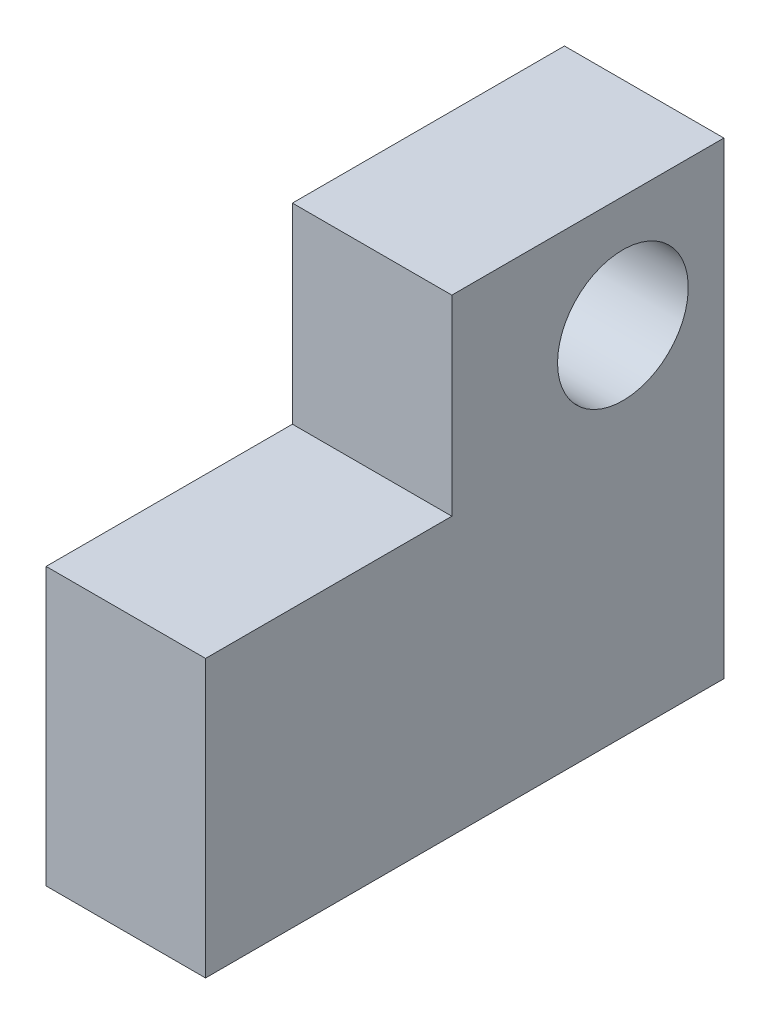
from build123d import *

# Parameters (mm, degrees)
SKETCH1_W            = 42.5
SKETCH1_H            = 55.85
BOSS_EXTRUDE2_DEPTH  = 42.5
SKETCH5_R            = 3
CUT_EXTRUDE2_DEPTH   = 42.5
SKETCH6_W            = 42.5
SKETCH6_H            = 42.5
CUT_EXTRUDE3_DEPTH   = 39.5
SKETCH7_R            = 12
SKETCH7_R_2          = 1.5
CUT_EXTRUDE4_DEPTH   = 39.5
SKETCH9_W            = 10
SKETCH9_H            = 42.5
CUT_EXTRUDE5_DEPTH   = 39.5
CHAMFER1_SIZE        = 3
CHAMFER2_SIZE        = 2
SKETCH10_W           = 2
SKETCH10_H           = 2.21509362
BOSS_EXTRUDE3_DEPTH  = 3
SKETCH12_W           = 2
SKETCH12_H           = 3
BOSS_EXTRUDE4_DEPTH  = 3
BOSS_EXTRUDE5_DEPTH  = 2
BOSS_EXTRUDE6_DEPTH  = 2
SKETCH16_W           = 9
SKETCH16_H           = 9
SKETCH16_R           = 3.175
BOSS_EXTRUDE8_DEPTH  = 5
SKETCH17_R           = 3
CUT_EXTRUDE6_DEPTH   = 5
SKETCH18_W           = 9
SKETCH18_H           = 7.183282928
BOSS_EXTRUDE9_DEPTH  = 2
SKETCH19_R           = 3.175
CUT_EXTRUDE7_DEPTH   = 5
SKETCH20_W           = 36.5
SKETCH20_H           = 45.349147475
CUT_EXTRUDE9_DEPTH   = 66
CUT_EXTRUDE10_DEPTH  = 66
SKETCH22_R           = 12
SKETCH22_R_2         = 11.45
SKETCH22_R_3         = 1.5
SKETCH22_R_4         = 1.55
BOSS_EXTRUDE13_DEPTH = 3
SKETCH23_W           = 42.5
SKETCH23_H           = 7.46509362
CUT_EXTRUDE11_DEPTH  = 3
CHAMFER3_SIZE        = 2
SKETCH24_R           = 13.75
SKETCH24_R_2         = 11.45
BOSS_EXTRUDE14_DEPTH = 4
BOSS_EXTRUDE15_START = 10
SKETCH25_W           = 42.5
SKETCH25_H           = 33.508189308
SKETCH25_R           = 3.175
BOSS_EXTRUDE15_DEPTH = 10
CUT_EXTRUDE12_DEPTH  = 142
CHAMFER4_SIZE        = 10
SKETCH27_W           = 1.831902159
SKETCH27_H           = 1.026975453
BOSS_EXTRUDE16_DEPTH = 0.2
SKETCH28_R           = 3.175
BOSS_EXTRUDE17_DEPTH = 10
SKETCH29_R           = 6.15
BOSS_EXTRUDE19_DEPTH = 15
CUT_EXTRUDE13_DEPTH  = 50


with BuildPart() as part:
    # Sketch1 → Boss-Extrude2 (new body)
    with BuildSketch(Plane.XY):
        with Locations((-16.653499003, 3.960644895)):
            Rectangle(SKETCH1_W, SKETCH1_H)
    extrude(amount=BOSS_EXTRUDE2_DEPTH)

    # Sketch5 → Cut-Extrude2 (cut)
    with BuildSketch(Plane.XY.offset(42.5)):
        with Locations((-31.903499003, 25.965832134)):
            Circle(SKETCH5_R)
        with Locations(Location((-1.403499003, 25.965832134, 0), (0, 0, 180))):
            Circle(SKETCH5_R)
    extrude(amount=-CUT_EXTRUDE2_DEPTH, mode=Mode.SUBTRACT)

    # Sketch6 → Cut-Extrude3 (cut)
    with BuildSketch(Plane.ZY.offset(37.903499003)):
        with Locations((21.25, -0.499261485)):
            Rectangle(SKETCH6_W, SKETCH6_H)
    extrude(amount=-CUT_EXTRUDE3_DEPTH, mode=Mode.SUBTRACT)

    # Sketch7 → Cut-Extrude4 (cut)
    with BuildSketch(Plane(origin=(4.596500997, 0, 0), x_dir=(0, 0, -1), z_dir=(1, 0, 0))):
        with Locations((-21.25, -0.499261485)):
            Circle(SKETCH7_R)
        with Locations((-37, -16.249261485)):
            Circle(SKETCH7_R_2)
        with Locations((-5.5, -16.249261485)):
            Circle(SKETCH7_R_2)
        with Locations((-37, 14.750738515)):
            Circle(SKETCH7_R_2)
        with Locations((-5.5, 14.750738515)):
            Circle(SKETCH7_R_2)
    extrude(amount=-CUT_EXTRUDE4_DEPTH, mode=Mode.SUBTRACT)

    # Sketch9 → Cut-Extrude5 (cut)
    with BuildSketch(Plane.XZ.offset(23.964355105)):
        with Locations((-32.903499003, 21.25)):
            Rectangle(SKETCH9_W, SKETCH9_H)
    extrude(amount=-CUT_EXTRUDE5_DEPTH, mode=Mode.SUBTRACT)

    # Chamfer1
    chamfer1_edges = [part.edges().sort_by_distance(p)[0] for p in [
        (-37.903499003, 20.750738515, 21.25),
        (-37.903499003, 31.885644895, 21.25),
    ]]
    chamfer(chamfer1_edges, length=CHAMFER1_SIZE)

    # Chamfer2
    chamfer2_edges = [part.edges().sort_by_distance(p)[0] for p in [
        (4.596500997, -23.964355105, 21.25),
    ]]
    chamfer(chamfer2_edges, length=CHAMFER2_SIZE)

    # Sketch10 → Boss-Extrude3 (add)
    with BuildSketch(Plane.ZY.offset(27.903499003)):
        with Locations((43.5, -22.856808295)):
            Rectangle(SKETCH10_W, SKETCH10_H)
        with Locations((-1, -22.856808295)):
            Rectangle(SKETCH10_W, SKETCH10_H)
    extrude(amount=-BOSS_EXTRUDE3_DEPTH)

    # Sketch12 → Boss-Extrude4 (add)
    with BuildSketch(Plane.ZY.offset(-1.596500997)):
        with Locations((43.5, 19.250738515)):
            Rectangle(SKETCH12_W, SKETCH12_H)
        with Locations((-1, 19.250738515)):
            Rectangle(SKETCH12_W, SKETCH12_H)
    extrude(amount=-BOSS_EXTRUDE4_DEPTH)

    # Sketch13 → Boss-Extrude5 (add)
    with BuildSketch(Plane(origin=(0, 0, -2), x_dir=(-1, 0, 0), z_dir=(0, 0, -1))):
        Polygon((-1.596500997, 17.750738515), (24.903499003, -21.749261485), (27.903499003, -21.749261485), (-1.596500997, 20.750738515), align=None)
    extrude(amount=-BOSS_EXTRUDE5_DEPTH)

    # Sketch14 → Boss-Extrude6 (add)
    with BuildSketch(Plane.XY.offset(44.5)):
        Polygon((1.596500997, 17.750738515), (-24.903499003, -21.749261485), (-27.903499003, -21.749261485), (1.596500997, 20.750738515), align=None)
    extrude(amount=-BOSS_EXTRUDE6_DEPTH)

    # Sketch16 → Boss-Extrude8 (add)
    # profile 1 of 2: a face of its own
    with BuildSketch(Plane(origin=(4.596500997, 0, 0), x_dir=(0, 0, -1), z_dir=(1, 0, 0))):
        with Locations((-38, 34.568927823)):
            Rectangle(SKETCH16_W, SKETCH16_H)
        with Locations((-38, 34.568927823)):
            Circle(SKETCH16_R, mode=Mode.SUBTRACT)
    # profile 2 of 2: a face of its own
    with BuildSketch(Plane(origin=(4.596500997, 0, 0), x_dir=(0, 0, -1), z_dir=(1, 0, 0))):
        with Locations((-4.5, 34.568927823)):
            Rectangle(SKETCH16_W, SKETCH16_H)
        with Locations((-4.5, 34.568927823)):
            Circle(SKETCH16_R, mode=Mode.SUBTRACT)
    extrude(amount=-BOSS_EXTRUDE8_DEPTH)

    # Sketch17 → Cut-Extrude6 (cut)
    with BuildSketch(Plane(origin=(4.596500997, 0, 0), x_dir=(0, 0, -1), z_dir=(1, 0, 0))):
        with Locations((-38, 34.568927823)):
            Circle(SKETCH17_R)
        with Locations((-4.5, 34.568927823)):
            Circle(SKETCH17_R)
    extrude(amount=-CUT_EXTRUDE6_DEPTH, mode=Mode.SUBTRACT)

    # Sketch18 → Boss-Extrude9 (add)
    with BuildSketch(Plane.ZY.offset(0.403499003)):
        with Locations((4.5, 35.477286359)):
            Rectangle(SKETCH18_W, SKETCH18_H)
        with Locations((38, 35.477286359)):
            Rectangle(SKETCH18_W, SKETCH18_H)
    extrude(amount=BOSS_EXTRUDE9_DEPTH)

    # Sketch19 → Cut-Extrude7 (cut)
    with BuildSketch(Plane(origin=(4.596500997, 0, 0), x_dir=(0, 0, -1), z_dir=(1, 0, 0))):
        with Locations((-38, 34.568927823)):
            Circle(SKETCH19_R)
        with Locations(Location((-4.5, 34.568927823, 0), (0, 0, 180))):
            Circle(SKETCH19_R)
    extrude(amount=-CUT_EXTRUDE7_DEPTH, mode=Mode.SUBTRACT)

    # Sketch20 → Cut-Extrude9 (cut, symmetric)
    with BuildSketch(Plane.XY.offset(42.5)):
        with Locations((-16.653499003, -1.923835222)):
            Rectangle(SKETCH20_W, SKETCH20_H)
    extrude(amount=CUT_EXTRUDE9_DEPTH, both=True, mode=Mode.SUBTRACT)

    # Sketch21 → Cut-Extrude10 (cut, symmetric)
    with BuildSketch(Plane(origin=(4.596500997, 0, 0), x_dir=(0, 0, -1), z_dir=(1, 0, 0))):
        Polygon((0, 39.068927823), (0, -21.964355105), (2.461652374, -21.964355105), (3.037977258, 39.068927823), (0.568013469, 39.068927823), align=None)
        Polygon((-42.5, 39.068927823), (-42.5, -21.964355105), (-44.961652374, -21.964355105), (-45.537977258, 39.068927823), (-43.068013469, 39.068927823), align=None)
    extrude(amount=CUT_EXTRUDE10_DEPTH, both=True, mode=Mode.SUBTRACT)

    # Sketch22 → Boss-Extrude13 (add)
    # profile 1 of 5: a face of its own
    with BuildSketch(Plane(origin=(4.596500997, 0, 0), x_dir=(0, 0, -1), z_dir=(1, 0, 0))):
        with Locations((-21.25, -0.499261485)):
            Circle(SKETCH22_R)
        with Locations((-21.25, -0.499261485)):
            Circle(SKETCH22_R_2, mode=Mode.SUBTRACT)
    # profile 2 of 5: a face of its own
    with BuildSketch(Plane(origin=(4.596500997, 0, 0), x_dir=(0, 0, -1), z_dir=(1, 0, 0))):
        with Locations((-37, 14.750738515)):
            Circle(SKETCH22_R_3)
    # profile 3 of 5: a face of its own
    with BuildSketch(Plane(origin=(4.596500997, 0, 0), x_dir=(0, 0, -1), z_dir=(1, 0, 0))):
        with Locations((-5.524563877, 14.750738515)):
            Circle(SKETCH22_R_4)
    # profile 4 of 5: a face of its own
    with BuildSketch(Plane(origin=(4.596500997, 0, 0), x_dir=(0, 0, -1), z_dir=(1, 0, 0))):
        with Locations((-5.5, -16.249261485)):
            Circle(SKETCH22_R_3)
    # profile 5 of 5: a face of its own
    with BuildSketch(Plane(origin=(4.596500997, 0, 0), x_dir=(0, 0, -1), z_dir=(1, 0, 0))):
        with Locations((-37, -16.249261485)):
            Circle(SKETCH22_R_3)
    extrude(amount=-BOSS_EXTRUDE13_DEPTH)

    # Sketch23 → Cut-Extrude11 (cut)
    with BuildSketch(Plane(origin=(4.596500997, 0, 0), x_dir=(0, 0, -1), z_dir=(1, 0, 0))):
        with Locations((-21.25, -20.231808295)):
            Rectangle(SKETCH23_W, SKETCH23_H)
    extrude(amount=-CUT_EXTRUDE11_DEPTH, mode=Mode.SUBTRACT)

    # Chamfer3
    chamfer3_edges = [part.edges().sort_by_distance(p)[0] for p in [
        (4.596500997, -16.499261485, 21.25),
    ]]
    chamfer(chamfer3_edges, length=CHAMFER3_SIZE)

    # Sketch24 → Boss-Extrude14 (add)
    with BuildSketch(Plane.ZY.offset(-1.596500997)):
        with Locations(Location((21.25, -0.499261485, 0), (0, 0, 180))):
            Circle(SKETCH24_R)
        with Locations(Location((21.25, -0.499261485, 0), (0, 0, 180))):
            Circle(SKETCH24_R_2, mode=Mode.SUBTRACT)
    extrude(amount=BOSS_EXTRUDE14_DEPTH)

    # Sketch25 → Boss-Extrude15 (add)
    with BuildSketch(Plane(origin=(4.596500997, 0, 0), x_dir=(0, 0, -1), z_dir=(1, 0, 0)).offset(BOSS_EXTRUDE15_START)):
        with Locations((-21.25, 22.314833169)):
            Rectangle(SKETCH25_W, SKETCH25_H)
        with Locations((-38, 34.568927823)):
            Circle(SKETCH25_R, mode=Mode.SUBTRACT)
        with Locations((-4.5, 34.568927823)):
            Circle(SKETCH25_R, mode=Mode.SUBTRACT)
    extrude(amount=-BOSS_EXTRUDE15_DEPTH)

    # Sketch26 → Cut-Extrude12 (cut)
    with BuildSketch(Plane(origin=(0, 0, 0), x_dir=(-1, 0, 0), z_dir=(0, 0, -1))):
        Polygon((-4.596500997, 39.068927823), (-4.596500997, -17.856619688), (37.419914356, -17.856619688), (42.573197426, 39.068927823), align=None)
    extrude(amount=-CUT_EXTRUDE12_DEPTH, mode=Mode.SUBTRACT)

    # Chamfer4
    chamfer4_edges = [part.edges().sort_by_distance(p)[0] for p in [
        (9.596500997, 5.560738515, 42.5),
        (9.596500997, 5.560738515, 0),
    ]]
    chamfer(chamfer4_edges, length=CHAMFER4_SIZE)

    # Sketch27 → Boss-Extrude16 (add)
    with BuildSketch(Plane.XZ.offset(-5.560738515)):
        with Locations((11.95576893, 21.763487727)):
            Rectangle(SKETCH27_W, SKETCH27_H)
    extrude(amount=BOSS_EXTRUDE16_DEPTH)

    # Sketch28 → Boss-Extrude17 (add)
    with BuildSketch(Plane(origin=(14.596500997, 0, 0), x_dir=(0, 0, -1), z_dir=(1, 0, 0))):
        Polygon((-42.578884897, 40.068927823), (0, 40.068927823), (1, 40.068927823), (1, 15.146524953), (-8.635786438, 5.510738515), (-33.864213562, 5.510738515), (-43.5, 15.146524953), (-43.5, 40.068927823), align=None)
        with Locations((-38, 34.568927823)):
            Circle(SKETCH28_R, mode=Mode.SUBTRACT)
        with Locations((-4.5, 34.568927823)):
            Circle(SKETCH28_R, mode=Mode.SUBTRACT)
    extrude(amount=-BOSS_EXTRUDE17_DEPTH)

    # Sketch29 → Boss-Extrude19 (add)
    with BuildSketch(Plane.ZY.offset(-4.596500997)):
        Polygon((-5, 45.068927823), (-5, 1.010738515), (43.772310913, 1.010738515), (43.772310913, 27.051079093), (20.597179394, 27.051079093), (20.597179394, 45.068927823), align=None)
        with Locations(Location((4.5, 34.568927823, 0), (0, 0, 153.419803228))):
            Circle(SKETCH29_R, mode=Mode.SUBTRACT)
    extrude(amount=BOSS_EXTRUDE19_DEPTH)

    # Sketch30 → Cut-Extrude13 (cut)
    with BuildSketch(Plane.XY.offset(43.772310913)):
        Polygon((4.596500997, 40.068927823), (4.596500997, 5.510738515), (14.596500997, 4.365687142), (14.596500997, 40.068927823), align=None)
    extrude(amount=-CUT_EXTRUDE13_DEPTH, mode=Mode.SUBTRACT)


solid = part.part
